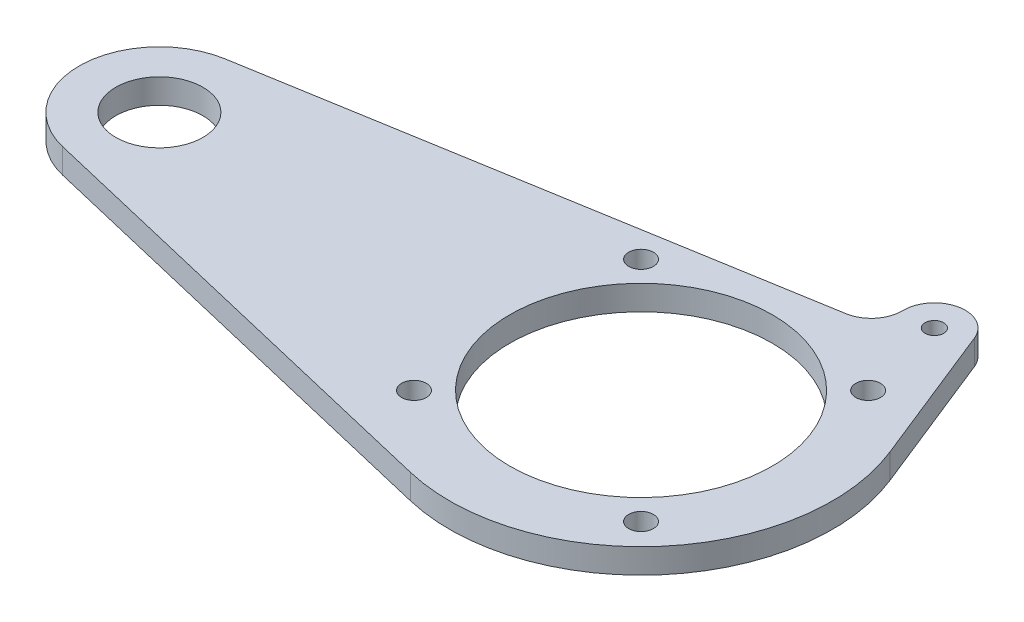
from build123d import *

# Parameters (mm, degrees)
SKETCH1_R           = 7.05
SKETCH1_R_2         = 1.5
SKETCH1_R_3         = 2
SKETCH1_R_4         = 21.25
BOSS_EXTRUDE1_DEPTH = 4


with BuildPart() as part:
    # Sketch1 → Boss-Extrude1 (new body)
    with BuildSketch(Plane(origin=(0, 0, 0), x_dir=(1, 0, 0), z_dir=(0, 1, 0))):
        with BuildLine():
            Line((-80.166666667, 12.818172863), (5.835638785, 27.355215737))
            ThreePointArc((5.835638785, 27.355215737), (8.855550352, 29.098982843), (10.001152726, 32.392641112))
            ThreePointArc((10.001152726, 32.392641112), (14.001538866, 37.399293353), (19.642183216, 34.3574539))
            Line((19.642183216, 34.3574539), (28.781535937, 11.516214183))
            ThreePointArc((28.781535937, 11.516214183), (23.478372246, -20.242678595), (-7.153846154, -30.163263835))
            Line((-7.153846154, -30.163263835), (-81, -12.649110641))
            ThreePointArc((-81, -12.649110641), (-90.993045962, 0.425154819), (-80.166666667, 12.818172863))
        make_face()
        with Locations(Location((-78, 0, 0), (0, 0, 270))):
            Circle(SKETCH1_R, mode=Mode.SUBTRACT)
        with Locations(Location((15, 32.5, 0), (0, 0, 270))):
            Circle(SKETCH1_R_2, mode=Mode.SUBTRACT)
        with Locations(Location((-18.384776311, 18.384776311, 0), (0, 0, 270))):
            Circle(SKETCH1_R_3, mode=Mode.SUBTRACT)
        with Locations(Location((18.384776311, 18.384776311, 0), (0, 0, 270))):
            Circle(SKETCH1_R_3, mode=Mode.SUBTRACT)
        with Locations(Location((18.384776311, -18.384776311, 0), (0, 0, 270))):
            Circle(SKETCH1_R_3, mode=Mode.SUBTRACT)
        with Locations(Location((-18.384776311, -18.384776311, 0), (0, 0, 270))):
            Circle(SKETCH1_R_3, mode=Mode.SUBTRACT)
        with Locations(Location((0, 0, 0), (0, 0, 270))):
            Circle(SKETCH1_R_4, mode=Mode.SUBTRACT)
    extrude(amount=BOSS_EXTRUDE1_DEPTH)


solid = part.part
